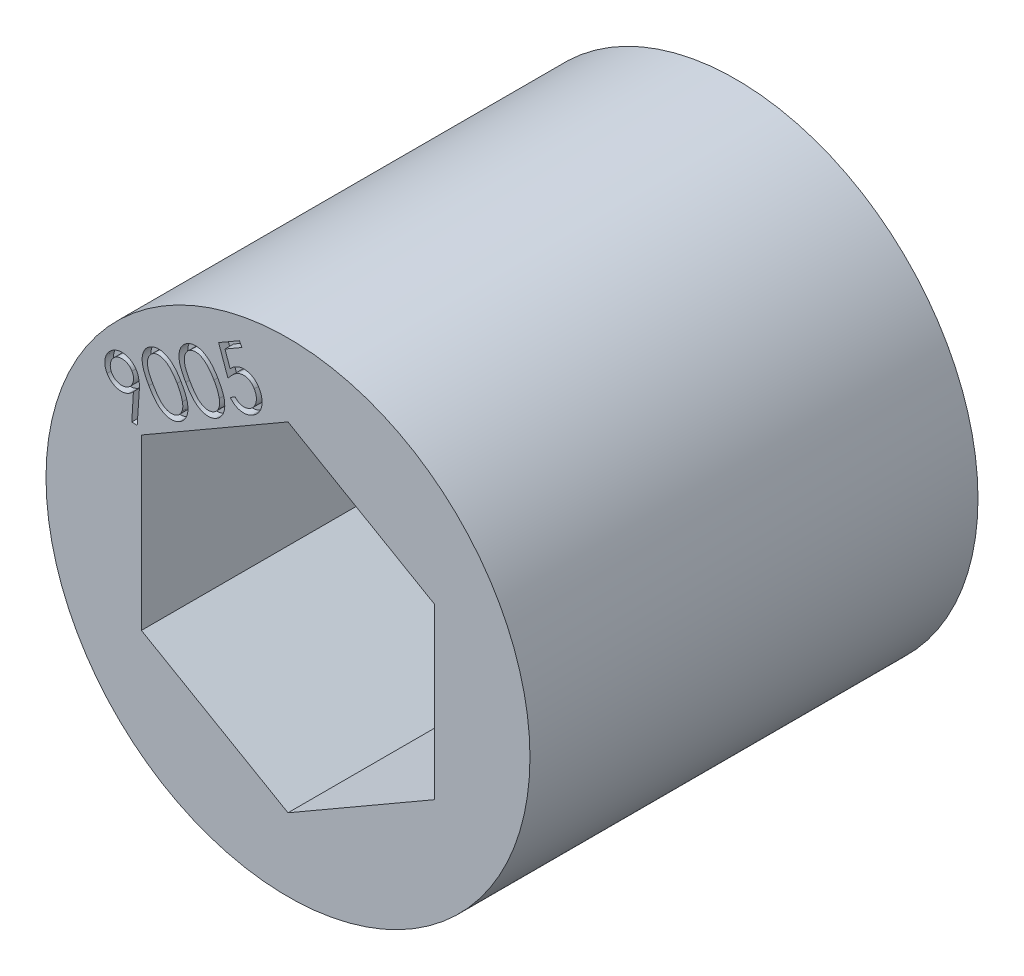
from build123d import *

# Parameters (mm, degrees)
SKETCH1_R           = 11.1125
BOSS_EXTRUDE1_DEPTH = 20.574
CUT_EXTRUDE1_DEPTH  = 0.4


with BuildPart() as part:
    # Sketch1 → Boss-Extrude1 (new body)
    with BuildSketch(Plane.XY):
        Circle(SKETCH1_R)
        Polygon((6.731, 3.886144662), (0, 7.772289324), (-6.731, 3.886144662), (-6.731, -3.886144662), (0, -7.772289324), (6.731, -3.886144662), align=None, mode=Mode.SUBTRACT)
    extrude(amount=BOSS_EXTRUDE1_DEPTH)

    # Sketch2 → Cut-Extrude1 (cut)
    # profile 1 of 4: a face of its own
    with BuildSketch(Plane.XY.offset(20.574)):
        with BuildLine():
            Line((-6.924573237, 4.169554117), (-7.172365705, 4.181765656))
            Line((-7.172365705, 4.181765656), (-7.099096474, 5.424798508))
            add(Edge.make_bspline(
                [(-7.099096474, 5.424798508), (-7.115082491, 5.407369556), (-7.146178835, 5.373466383), (-7.196679552, 5.328749615), (-7.247249931, 5.28893276), (-7.283061917, 5.267076576), (-7.300586859, 5.25638104)],
                knots=[0, 0, 0, 0, 1.07557127, 2.092224476, 3.066411598, 4, 4, 4, 4], degree=3))
            add(Edge.make_bspline(
                [(-7.300586859, 5.25638104), (-7.322245392, 5.244562458), (-7.365097755, 5.221178871), (-7.432394268, 5.194463627), (-7.500523976, 5.17467734), (-7.5697037, 5.163292848), (-7.639544965, 5.157833849), (-7.710525739, 5.160562601), (-7.782232964, 5.170921978), (-7.854086187, 5.188195988), (-7.924350337, 5.211812561), (-7.991348699, 5.241942907), (-8.054290519, 5.278203693), (-8.112922484, 5.320700807), (-8.167757247, 5.368767428), (-8.218277127, 5.422903097), (-8.264381974, 5.483418603), (-8.291278489, 5.527163849), (-8.304985897, 5.549457963)],
                knots=[0, 0, 0, 0, 1.015135184, 2.008489705, 2.974464217, 3.930823522, 4.890110555, 5.854468119, 6.84900024, 7.868689235, 8.893387844, 9.896732215, 10.888539014, 11.878968029, 12.873598221, 13.886496971, 14.922884625, 16, 16, 16, 16], degree=3))
            add(Edge.make_bspline(
                [(-8.304985897, 5.549457963), (-8.321829372, 5.580937848), (-8.35496852, 5.642873798), (-8.388523348, 5.74147864), (-8.41038059, 5.841169826), (-8.416390713, 5.942269443), (-8.410354933, 6.043160996), (-8.3888868, 6.142193846), (-8.354424656, 6.238857598), (-8.306747334, 6.331822917), (-8.247413823, 6.418819647), (-8.178679286, 6.497913682), (-8.099373913, 6.566649861), (-8.040250165, 6.603786522), (-8.010382532, 6.622546906)],
                knots=[0, 0, 0, 0, 1.035324533, 2.036977218, 3.013660684, 3.991039457, 4.968418229, 5.940283026, 6.923354643, 7.941094773, 8.965736768, 9.974485588, 10.976767849, 12, 12, 12, 12], degree=3))
            add(Edge.make_bspline(
                [(-8.010382532, 6.622546906), (-7.979910899, 6.638850823), (-7.919650887, 6.671093082), (-7.822977976, 6.703912105), (-7.723620108, 6.724036171), (-7.622366935, 6.731027877), (-7.521005812, 6.725244635), (-7.42209833, 6.705076571), (-7.326179688, 6.671818439), (-7.23552206, 6.624246651), (-7.150604524, 6.566583058), (-7.074244034, 6.499137059), (-7.007686175, 6.422178737), (-6.971693304, 6.364911211), (-6.953575641, 6.336084566)],
                knots=[0, 0, 0, 0, 1.019400264, 2.015942902, 3.002372847, 4.006779929, 5.005536382, 5.991966327, 6.979044859, 7.994053264, 9.007032045, 10.004279611, 10.995418019, 12, 12, 12, 12], degree=3))
            add(Edge.make_bspline(
                [(-6.953575641, 6.336084566), (-6.94108065, 6.31272698), (-6.915652645, 6.265192989), (-6.885381609, 6.188386689), (-6.861133323, 6.106084415), (-6.845411218, 6.033562631), (-6.836154063, 5.971895301), (-6.830329714, 5.921683006), (-6.827289712, 5.867998445), (-6.824338922, 5.810852315), (-6.824147449, 5.750433103), (-6.825154461, 5.686480995), (-6.8276696, 5.619128602), (-6.830514546, 5.573027762), (-6.831969071, 5.549457963)],
                knots=[0, 0, 0, 0, 1.179517641, 2.400384276, 3.669978525, 4.99951221, 5.702757638, 6.447991837, 7.250775919, 8.098000084, 8.997311831, 9.942054579, 10.947842213, 12, 12, 12, 12], degree=3))
            Line((-6.831969071, 5.549457963), (-6.924573237, 4.169554117))
        make_face()
        with BuildLine():
            add(Edge.make_bspline(
                [(-7.361135737, 5.478223989), (-7.345487269, 5.487746706), (-7.314754829, 5.50644862), (-7.272925048, 5.539525135), (-7.234809529, 5.575039337), (-7.201759778, 5.61461068), (-7.172554575, 5.656996981), (-7.147610177, 5.702548092), (-7.126426025, 5.751143971), (-7.110705102, 5.802616363), (-7.0986576, 5.855119612), (-7.092896712, 5.907849387), (-7.090958642, 5.959787747), (-7.095079997, 6.011179891), (-7.105043932, 6.061513312), (-7.119192538, 6.111409675), (-7.139177576, 6.16045437), (-7.156127013, 6.191897442), (-7.164733494, 6.207863412)],
                knots=[0, 0, 0, 0, 1.045108442, 2.052516081, 3.039037663, 4.014948609, 4.990090363, 5.974041511, 6.976128051, 8.011453109, 9.043011603, 10.047295345, 11.035574291, 12.007150616, 12.98344593, 13.961229243, 14.964765542, 16, 16, 16, 16], degree=3))
            add(Edge.make_bspline(
                [(-7.164733494, 6.207863412), (-7.174089133, 6.223337647), (-7.192579766, 6.25392117), (-7.225361936, 6.295555785), (-7.261221691, 6.333165381), (-7.300583692, 6.366255071), (-7.343021549, 6.395378721), (-7.388421649, 6.420501289), (-7.437279658, 6.440887199), (-7.48859131, 6.45687647), (-7.541170457, 6.468569984), (-7.59379444, 6.475439698), (-7.645815305, 6.476342459), (-7.697101746, 6.472242177), (-7.747829859, 6.463193366), (-7.797786368, 6.448045864), (-7.847496015, 6.428546419), (-7.87894757, 6.411079557), (-7.894881731, 6.402230399)],
                knots=[0, 0, 0, 0, 1.031712043, 2.039092063, 3.018573684, 3.994457873, 4.969572892, 5.953497063, 6.951758218, 7.98705489, 9.018585102, 10.024008046, 11.012022604, 11.983572292, 12.958061913, 13.947831088, 14.960318852, 16, 16, 16, 16], degree=3))
            add(Edge.make_bspline(
                [(-7.894881731, 6.402230399), (-7.910388278, 6.392913988), (-7.940921187, 6.374569665), (-7.982097239, 6.341251164), (-8.020219854, 6.305954392), (-8.053196364, 6.26632484), (-8.082544826, 6.224113666), (-8.106768331, 6.178261226), (-8.128105712, 6.129841495), (-8.143774813, 6.078340812), (-8.155836626, 6.025845148), (-8.161573927, 5.973282237), (-8.163530138, 5.921515103), (-8.159407983, 5.870292051), (-8.149447912, 5.819958724), (-8.135298263, 5.770062336), (-8.115313509, 5.721017647), (-8.098364033, 5.689574574), (-8.089757532, 5.673608604)],
                knots=[0, 0, 0, 0, 1.034021631, 2.036022986, 3.024725885, 4.002794686, 4.980092595, 5.961574923, 6.965877195, 8.00349148, 9.037330872, 10.043835206, 11.024597356, 11.998321951, 12.97677597, 13.956721278, 14.962476515, 16, 16, 16, 16], degree=3))
            add(Edge.make_bspline(
                [(-8.089757532, 5.673608604), (-8.080402299, 5.658133752), (-8.061912467, 5.627549009), (-8.029124446, 5.585923294), (-7.993286198, 5.548280986), (-7.953951832, 5.515402013), (-7.911936753, 5.485891939), (-7.866435331, 5.461124337), (-7.817859582, 5.439909893), (-7.766381593, 5.424197392), (-7.713879847, 5.412147629), (-7.661149682, 5.406387328), (-7.609211423, 5.404449106), (-7.557819252, 5.4085705), (-7.507485838, 5.418534425), (-7.457589474, 5.432683034), (-7.408544779, 5.452668071), (-7.377101707, 5.469617508), (-7.361135737, 5.478223989)],
                knots=[0, 0, 0, 0, 1.033571637, 2.042767394, 3.024014467, 4.001657624, 4.970548117, 5.956245748, 6.96011096, 7.997273687, 9.030663166, 10.03672948, 11.026762591, 12.000063433, 12.97809164, 13.957610489, 14.962928033, 16, 16, 16, 16], degree=3))
        make_face(mode=Mode.SUBTRACT)
    # profile 2 of 4: a face of its own
    with BuildSketch(Plane.XY.offset(20.574)):
        with BuildLine():
            add(Edge.make_bspline(
                [(-6.389027288, 6.017566938), (-6.409133435, 6.05287131), (-6.448236952, 6.121533154), (-6.500873973, 6.223940657), (-6.5479921, 6.321471948), (-6.588289918, 6.414639381), (-6.622135347, 6.503195954), (-6.649104818, 6.587324729), (-6.670478205, 6.66685528), (-6.684728435, 6.74258894), (-6.693459759, 6.815023383), (-6.697441648, 6.88469611), (-6.697696161, 6.952166749), (-6.693111178, 7.017469604), (-6.684045888, 7.080591596), (-6.670272779, 7.141511165), (-6.651816049, 7.200122602), (-6.629460311, 7.256615341), (-6.6032926, 7.310614152), (-6.572189244, 7.360976223), (-6.539018056, 7.4090837), (-6.501460957, 7.453283246), (-6.461212994, 7.495043123), (-6.416749354, 7.532866127), (-6.369393739, 7.568459362), (-6.335448189, 7.58906299), (-6.318302128, 7.599469982)],
                knots=[0, 0, 0, 0, 1.642217524, 3.193873097, 4.653599743, 6.020219012, 7.296149585, 8.484364078, 9.590266645, 10.622995624, 11.596731579, 12.537641419, 13.442669779, 14.322439731, 15.181528583, 16.018162769, 16.844365298, 17.663022962, 18.472528165, 19.266229043, 20.053716379, 20.832379209, 21.608138827, 22.395685855, 23.18965321, 24, 24, 24, 24], degree=3))
            add(Edge.make_bspline(
                [(-6.318302128, 7.599469982), (-6.300474489, 7.609271708), (-6.265131437, 7.628703497), (-6.209787585, 7.652335356), (-6.154045959, 7.672499617), (-6.096960794, 7.687280903), (-6.039102527, 7.697404539), (-5.980071677, 7.703057454), (-5.920188094, 7.704033863), (-5.859484113, 7.700372492), (-5.798152383, 7.692430856), (-5.736739105, 7.678593604), (-5.675517251, 7.65940816), (-5.613945721, 7.636279306), (-5.553264257, 7.606380908), (-5.492313163, 7.572026405), (-5.431183668, 7.533035334), (-5.370608651, 7.487827675), (-5.309343602, 7.437200437), (-5.248722903, 7.379183566), (-5.187834446, 7.314197984), (-5.127591655, 7.241999672), (-5.067536628, 7.162618397), (-5.006762535, 7.076751546), (-4.947049745, 6.983043093), (-4.908357548, 6.917603706), (-4.8885345, 6.884077354)],
                knots=[0, 0, 0, 0, 0.815881076, 1.617473213, 2.411751612, 3.192532544, 3.980223438, 4.766442947, 5.569622482, 6.380892254, 7.204795063, 8.048528362, 8.903143009, 9.777765604, 10.684831081, 11.614241792, 12.584586996, 13.591843045, 14.645331516, 15.771781295, 16.956234458, 18.217113798, 19.542884518, 20.949560407, 22.437178076, 24, 24, 24, 24], degree=3))
            add(Edge.make_bspline(
                [(-4.8885345, 6.884077354), (-4.869530652, 6.850255126), (-4.832467548, 6.784291814), (-4.781234767, 6.686184653), (-4.737228342, 6.591081689), (-4.698597399, 6.499763578), (-4.666653096, 6.411920287), (-4.640306006, 6.327614929), (-4.620396404, 6.246737064), (-4.6063935, 6.169055221), (-4.598603188, 6.094211015), (-4.593971274, 6.022202966), (-4.595400477, 5.952523966), (-4.599979685, 5.885128312), (-4.610491525, 5.820080305), (-4.624506818, 5.757237794), (-4.643374509, 5.696973407), (-4.666941719, 5.639407798), (-4.694183707, 5.584543463), (-4.725674846, 5.533004056), (-4.759484853, 5.483999185), (-4.797252883, 5.438330896), (-4.839447463, 5.396814623), (-4.883987575, 5.35750714), (-4.93219409, 5.321382207), (-4.966703412, 5.300529969), (-4.984191551, 5.289962771)],
                knots=[0, 0, 0, 0, 1.558572261, 3.039675171, 4.44500239, 5.767404933, 7.021920233, 8.19867626, 9.314183841, 10.366093107, 11.366862767, 12.335955634, 13.262731656, 14.164729598, 15.047477431, 15.907015182, 16.749641984, 17.580952634, 18.403702246, 19.207672054, 20.005351578, 20.794016824, 21.584181799, 22.380929523, 23.179510693, 24, 24, 24, 24], degree=3))
            add(Edge.make_bspline(
                [(-4.984191551, 5.289962771), (-5.001707815, 5.280398375), (-5.036487948, 5.261407397), (-5.090424565, 5.237293305), (-5.145760575, 5.218713906), (-5.201565282, 5.203563548), (-5.258522917, 5.194204812), (-5.316138998, 5.188366749), (-5.374836605, 5.187510596), (-5.434253982, 5.19085035), (-5.493895069, 5.199844146), (-5.553639391, 5.212682554), (-5.612762156, 5.232078045), (-5.672049751, 5.255375395), (-5.731144466, 5.284104522), (-5.790200814, 5.31763903), (-5.848795364, 5.35668413), (-5.907832517, 5.400497199), (-5.966485881, 5.451344089), (-6.025807257, 5.50924311), (-6.085659079, 5.574770443), (-6.145595752, 5.648407462), (-6.206315193, 5.729467377), (-6.266921655, 5.818563605), (-6.328918742, 5.914869108), (-6.368587219, 5.982644272), (-6.389027288, 6.017566938)],
                knots=[0, 0, 0, 0, 0.807491903, 1.603348545, 2.386916451, 3.167713854, 3.940658363, 4.719915701, 5.50935356, 6.313835313, 7.125313705, 7.947948844, 8.783651521, 9.640150085, 10.524255013, 11.440287308, 12.386399569, 13.372019105, 14.413529699, 15.525036669, 16.724996316, 18.002813491, 19.365932914, 20.822335035, 22.362637201, 24, 24, 24, 24], degree=3))
        make_face()
        with BuildLine():
            add(Edge.make_bspline(
                [(-6.178887064, 6.133067739), (-6.161426429, 6.103110337), (-6.127615012, 6.045099717), (-6.075562681, 5.962541829), (-6.024679761, 5.886803909), (-5.975569273, 5.817418966), (-5.927311523, 5.755166928), (-5.879859047, 5.700199785), (-5.834156819, 5.65148208), (-5.789064755, 5.609378951), (-5.744235972, 5.572833103), (-5.699427311, 5.540619065), (-5.654149077, 5.512669859), (-5.608806841, 5.488586996), (-5.563034266, 5.468596404), (-5.517073037, 5.452114899), (-5.470451641, 5.440634387), (-5.40939359, 5.4296989), (-5.334415628, 5.425511888), (-5.247777632, 5.434167276), (-5.165788161, 5.45555361), (-5.1162741, 5.480855148), (-5.091551326, 5.493488412)],
                knots=[0, 0, 0, 0, 1.475228016, 2.856686104, 4.15161897, 5.357081144, 6.47289893, 7.501387829, 8.445726694, 9.313720896, 10.124066195, 10.905058304, 11.660046733, 12.386348828, 13.08755313, 13.783651734, 14.460982071, 15.127735434, 16.421461315, 17.639985157, 18.821625413, 20, 20, 20, 20], degree=3))
            add(Edge.make_bspline(
                [(-5.091551326, 5.493488412), (-5.068050045, 5.508642633), (-5.021313431, 5.538779584), (-4.961478465, 5.598510023), (-4.911472366, 5.668409922), (-4.878039915, 5.734188546), (-4.85741428, 5.791297255), (-4.844382179, 5.836586753), (-4.836028368, 5.884173817), (-4.830714321, 5.933481805), (-4.830160258, 5.98468181), (-4.831895448, 6.037724108), (-4.838141277, 6.092619979), (-4.844899008, 6.129541753), (-4.848338185, 6.148332162)],
                knots=[0, 0, 0, 0, 1.342886321, 2.670576022, 4.038999414, 5.466462105, 6.205051725, 6.959707281, 7.731476591, 8.527516338, 9.344012544, 10.193626534, 11.080691652, 12, 12, 12, 12], degree=3))
            add(Edge.make_bspline(
                [(-4.848338185, 6.148332162), (-4.853141463, 6.172143603), (-4.862917253, 6.220605433), (-4.883241578, 6.293308409), (-4.907130982, 6.367897796), (-4.935515036, 6.443785885), (-4.968511178, 6.52100751), (-5.005013452, 6.599902304), (-5.046232724, 6.680377927), (-5.076591587, 6.733750011), (-5.092060141, 6.760944341)],
                knots=[0, 0, 0, 0, 0.879876913, 1.790754508, 2.73331625, 3.717259664, 4.725112015, 5.77538776, 6.866507818, 8, 8, 8, 8], degree=3))
            add(Edge.make_bspline(
                [(-5.092060141, 6.760944341), (-5.10779362, 6.787870192), (-5.138577546, 6.840552969), (-5.187171406, 6.915532581), (-5.23481293, 6.986156956), (-5.283133724, 7.051404219), (-5.332035694, 7.111199826), (-5.38028546, 7.166630757), (-5.429164096, 7.216445862), (-5.478121542, 7.261411746), (-5.526964594, 7.301536188), (-5.575131793, 7.337407737), (-5.623421228, 7.368040967), (-5.671156297, 7.394770451), (-5.718883008, 7.416498809), (-5.766067149, 7.4341661), (-5.813070596, 7.44701248), (-5.874327029, 7.457455208), (-5.948859172, 7.461753569), (-6.034923974, 7.45390492), (-6.116120824, 7.432318475), (-6.165175383, 7.407346344), (-6.18957216, 7.394926713)],
                knots=[0, 0, 0, 0, 1.327522451, 2.597413504, 3.803087542, 4.954092809, 6.052504639, 7.091116491, 8.08170511, 9.022070092, 9.919800897, 10.771882377, 11.577119672, 12.352806521, 13.099205072, 13.807429758, 14.495830891, 15.170113202, 16.450227669, 17.661618134, 18.837030004, 20, 20, 20, 20], degree=3))
            add(Edge.make_bspline(
                [(-6.18957216, 7.394926713), (-6.213108079, 7.379804023), (-6.260014083, 7.349665196), (-6.319558549, 7.289176728), (-6.370592085, 7.218882513), (-6.403603294, 7.151837696), (-6.425564344, 7.09426742), (-6.437351048, 7.048251661), (-6.446735168, 7.000730481), (-6.452444929, 6.951215807), (-6.453496603, 6.89985207), (-6.452395294, 6.846792003), (-6.446212657, 6.792159865), (-6.43786597, 6.735131452), (-6.424338023, 6.674922828), (-6.405316357, 6.610738959), (-6.38059286, 6.542128376), (-6.351092592, 6.468717826), (-6.315846632, 6.391109635), (-6.275361547, 6.308870657), (-6.229827267, 6.222012401), (-6.196212479, 6.163318957), (-6.178887064, 6.133067739)],
                knots=[0, 0, 0, 0, 1.186584607, 2.364808541, 3.584028067, 4.867913378, 5.52979883, 6.201670858, 6.884946004, 7.589109066, 8.317961587, 9.068444384, 9.84432244, 10.65432116, 11.518850237, 12.466086659, 13.499587148, 14.619373863, 15.830028341, 17.123623296, 18.517485242, 20, 20, 20, 20], degree=3))
        make_face(mode=Mode.SUBTRACT)
    # profile 3 of 4: a face of its own
    with BuildSketch(Plane.XY.offset(20.574)):
        with BuildLine():
            add(Edge.make_bspline(
                [(-4.696946884, 6.994490014), (-4.71705303, 7.029794386), (-4.756156547, 7.098456231), (-4.808793569, 7.200863734), (-4.855911696, 7.298395024), (-4.896209514, 7.391562458), (-4.930054943, 7.480119031), (-4.957024413, 7.564247806), (-4.9783978, 7.643778357), (-4.992648031, 7.719512017), (-5.001379354, 7.79194646), (-5.005361243, 7.861619187), (-5.005615756, 7.929089826), (-5.001030774, 7.994392681), (-4.991965484, 8.057514673), (-4.978192374, 8.118434241), (-4.959735644, 8.177045679), (-4.937379907, 8.233538418), (-4.911212196, 8.287537229), (-4.880108839, 8.337899299), (-4.846937652, 8.386006777), (-4.809380553, 8.430206323), (-4.769132589, 8.4719662), (-4.72466895, 8.509789204), (-4.677313335, 8.545382439), (-4.643367784, 8.565986067), (-4.626221723, 8.576393059)],
                knots=[0, 0, 0, 0, 1.642217524, 3.193873097, 4.653599743, 6.020219012, 7.296149585, 8.484364078, 9.590266645, 10.622995624, 11.596731579, 12.537641419, 13.442669779, 14.322439731, 15.181528583, 16.018162769, 16.844365298, 17.663022962, 18.472528165, 19.266229043, 20.053716379, 20.832379209, 21.608138827, 22.395685855, 23.18965321, 24, 24, 24, 24], degree=3))
            add(Edge.make_bspline(
                [(-4.626221723, 8.576393059), (-4.608394085, 8.586194785), (-4.573051033, 8.605626574), (-4.517707181, 8.629258433), (-4.461965555, 8.649422694), (-4.404880389, 8.66420398), (-4.347022123, 8.674327616), (-4.287991273, 8.679980531), (-4.22810769, 8.68095694), (-4.167403709, 8.677295569), (-4.106071979, 8.669353933), (-4.0446587, 8.655516681), (-3.983436846, 8.636331237), (-3.921865317, 8.613202383), (-3.861183853, 8.583303985), (-3.800232759, 8.548949482), (-3.739103264, 8.509958411), (-3.678528247, 8.464750752), (-3.617263198, 8.414123514), (-3.556642499, 8.356106643), (-3.495754042, 8.291121061), (-3.43551125, 8.218922749), (-3.375456224, 8.139541474), (-3.314682131, 8.053674623), (-3.254969341, 7.95996617), (-3.216277144, 7.894526783), (-3.196454095, 7.861000431)],
                knots=[0, 0, 0, 0, 0.815881076, 1.617473213, 2.411751612, 3.192532544, 3.980223438, 4.766442947, 5.569622482, 6.380892254, 7.204795063, 8.048528362, 8.903143009, 9.777765604, 10.684831081, 11.614241792, 12.584586996, 13.591843045, 14.645331516, 15.771781295, 16.956234458, 18.217113798, 19.542884518, 20.949560407, 22.437178076, 24, 24, 24, 24], degree=3))
            add(Edge.make_bspline(
                [(-3.196454095, 7.861000431), (-3.177450247, 7.827178203), (-3.140387144, 7.761214891), (-3.089154363, 7.66310773), (-3.045147938, 7.568004765), (-3.006516995, 7.476686655), (-2.974572692, 7.388843364), (-2.948225601, 7.304538006), (-2.928315999, 7.223660141), (-2.914313096, 7.145978298), (-2.906522783, 7.071134092), (-2.90189087, 6.999126042), (-2.903320072, 6.929447043), (-2.907899281, 6.862051389), (-2.918411121, 6.797003382), (-2.932426414, 6.734160871), (-2.951294105, 6.673896484), (-2.974861315, 6.616330875), (-3.002103303, 6.56146654), (-3.033594442, 6.509927133), (-3.067404448, 6.460922262), (-3.105172479, 6.415253973), (-3.147367059, 6.3737377), (-3.191907171, 6.334430217), (-3.240113685, 6.298305283), (-3.274623007, 6.277453046), (-3.292111146, 6.266885848)],
                knots=[0, 0, 0, 0, 1.558572261, 3.039675171, 4.44500239, 5.767404933, 7.021920233, 8.19867626, 9.314183841, 10.366093107, 11.366862767, 12.335955634, 13.262731656, 14.164729598, 15.047477431, 15.907015182, 16.749641984, 17.580952634, 18.403702246, 19.207672054, 20.005351578, 20.794016824, 21.584181799, 22.380929523, 23.179510693, 24, 24, 24, 24], degree=3))
            add(Edge.make_bspline(
                [(-3.292111146, 6.266885848), (-3.30962741, 6.257321452), (-3.344407543, 6.238330474), (-3.398344161, 6.214216382), (-3.45368017, 6.195636983), (-3.509484877, 6.180486625), (-3.566442512, 6.171127889), (-3.624058593, 6.165289826), (-3.682756201, 6.164433673), (-3.742173577, 6.167773427), (-3.801814665, 6.176767223), (-3.861558986, 6.189605631), (-3.920681752, 6.209001121), (-3.979969346, 6.232298472), (-4.039064062, 6.261027599), (-4.098120409, 6.294562107), (-4.15671496, 6.333607207), (-4.215752113, 6.377420276), (-4.274405477, 6.428267166), (-4.333726852, 6.486166187), (-4.393578674, 6.55169352), (-4.453515348, 6.625330539), (-4.514234788, 6.706390454), (-4.57484125, 6.795486682), (-4.636838337, 6.891792185), (-4.676506815, 6.959567349), (-4.696946884, 6.994490014)],
                knots=[0, 0, 0, 0, 0.807491903, 1.603348545, 2.386916451, 3.167713854, 3.940658363, 4.719915701, 5.50935356, 6.313835313, 7.125313705, 7.947948844, 8.783651521, 9.640150085, 10.524255013, 11.440287308, 12.386399569, 13.372019105, 14.413529699, 15.525036669, 16.724996316, 18.002813491, 19.365932914, 20.822335035, 22.362637201, 24, 24, 24, 24], degree=3))
        make_face()
        with BuildLine():
            add(Edge.make_bspline(
                [(-4.486806659, 7.109990816), (-4.469346025, 7.080033414), (-4.435534607, 7.022022794), (-4.383482277, 6.939464906), (-4.332599357, 6.863726986), (-4.283488868, 6.794342043), (-4.235231119, 6.732090005), (-4.187778642, 6.677122862), (-4.142076415, 6.628405157), (-4.096984351, 6.586302028), (-4.052155568, 6.54975618), (-4.007346907, 6.517542142), (-3.962068673, 6.489592936), (-3.916726437, 6.465510073), (-3.870953862, 6.445519481), (-3.824992633, 6.429037976), (-3.778371237, 6.417557464), (-3.717313185, 6.406621977), (-3.642335224, 6.402434964), (-3.555697227, 6.411090353), (-3.473707757, 6.432476687), (-3.424193695, 6.457778225), (-3.399470922, 6.470411489)],
                knots=[0, 0, 0, 0, 1.475228016, 2.856686104, 4.15161897, 5.357081144, 6.47289893, 7.501387829, 8.445726694, 9.313720896, 10.124066195, 10.905058304, 11.660046733, 12.386348828, 13.08755313, 13.783651734, 14.460982071, 15.127735434, 16.421461315, 17.639985157, 18.821625413, 20, 20, 20, 20], degree=3))
            add(Edge.make_bspline(
                [(-3.399470922, 6.470411489), (-3.37596964, 6.48556571), (-3.329233027, 6.515702661), (-3.269398061, 6.5754331), (-3.219391961, 6.645332999), (-3.18595951, 6.711111623), (-3.165333876, 6.768220332), (-3.152301774, 6.81350983), (-3.143947963, 6.861096894), (-3.138633917, 6.910404882), (-3.138079853, 6.961604887), (-3.139815043, 7.014647185), (-3.146060872, 7.069543056), (-3.152818604, 7.10646483), (-3.156257781, 7.125255239)],
                knots=[0, 0, 0, 0, 1.342886321, 2.670576022, 4.038999414, 5.466462105, 6.205051725, 6.959707281, 7.731476591, 8.527516338, 9.344012544, 10.193626534, 11.080691652, 12, 12, 12, 12], degree=3))
            add(Edge.make_bspline(
                [(-3.156257781, 7.125255239), (-3.161061059, 7.14906668), (-3.170836848, 7.19752851), (-3.191161173, 7.270231486), (-3.215050577, 7.344820873), (-3.243434631, 7.420708962), (-3.276430774, 7.497930587), (-3.312933047, 7.576825381), (-3.35415232, 7.657301004), (-3.384511183, 7.710673088), (-3.399979736, 7.737867418)],
                knots=[0, 0, 0, 0, 0.879876913, 1.790754508, 2.73331625, 3.717259664, 4.725112015, 5.77538776, 6.866507818, 8, 8, 8, 8], degree=3))
            add(Edge.make_bspline(
                [(-3.399979736, 7.737867418), (-3.415713216, 7.764793269), (-3.446497141, 7.817476046), (-3.495091002, 7.892455658), (-3.542732526, 7.963080033), (-3.59105332, 8.028327296), (-3.639955289, 8.088122903), (-3.688205055, 8.143553834), (-3.737083692, 8.193368939), (-3.786041138, 8.238334823), (-3.83488419, 8.278459265), (-3.883051388, 8.314330813), (-3.931340824, 8.344964044), (-3.979075893, 8.371693527), (-4.026802604, 8.393421886), (-4.073986745, 8.411089176), (-4.120990191, 8.423935557), (-4.182246625, 8.434378284), (-4.256778767, 8.438676646), (-4.342843569, 8.430827997), (-4.42404042, 8.409241552), (-4.473094979, 8.384269421), (-4.497491755, 8.37184979)],
                knots=[0, 0, 0, 0, 1.327522451, 2.597413504, 3.803087542, 4.954092809, 6.052504639, 7.091116491, 8.08170511, 9.022070092, 9.919800897, 10.771882377, 11.577119672, 12.352806521, 13.099205072, 13.807429758, 14.495830891, 15.170113202, 16.450227669, 17.661618134, 18.837030004, 20, 20, 20, 20], degree=3))
            add(Edge.make_bspline(
                [(-4.497491755, 8.37184979), (-4.521027674, 8.3567271), (-4.567933678, 8.326588273), (-4.627478145, 8.266099805), (-4.678511681, 8.19580559), (-4.711522889, 8.128760773), (-4.73348394, 8.071190497), (-4.745270643, 8.025174737), (-4.754654764, 7.977653558), (-4.760364525, 7.928138884), (-4.761416198, 7.876775147), (-4.760314889, 7.82371508), (-4.754132252, 7.769082942), (-4.745785566, 7.712054529), (-4.732257619, 7.651845905), (-4.713235953, 7.587662036), (-4.688512455, 7.519051453), (-4.659012188, 7.445640903), (-4.623766228, 7.368032712), (-4.583281143, 7.285793734), (-4.537746863, 7.198935478), (-4.504132074, 7.140242033), (-4.486806659, 7.109990816)],
                knots=[0, 0, 0, 0, 1.186584607, 2.364808541, 3.584028067, 4.867913378, 5.52979883, 6.201670858, 6.884946004, 7.589109066, 8.317961587, 9.068444384, 9.84432244, 10.65432116, 11.518850237, 12.466086659, 13.499587148, 14.619373863, 15.830028341, 17.123623296, 18.517485242, 20, 20, 20, 20], degree=3))
        make_face(mode=Mode.SUBTRACT)
    # profile 4 of 4: a face of its own
    with BuildSketch(Plane.XY.offset(20.574)):
        with BuildLine():
            Line((-2.232486672, 9.884554117), (-2.111388915, 9.675431521))
            Line((-2.111388915, 9.675431521), (-2.894453819, 9.223604598))
            Line((-2.894453819, 9.223604598), (-2.657855261, 8.560619822))
            add(Edge.make_bspline(
                [(-2.657855261, 8.560619822), (-2.638218533, 8.580338731), (-2.600092727, 8.618624094), (-2.541381873, 8.670652555), (-2.482526582, 8.71488419), (-2.442302052, 8.739829327), (-2.422783146, 8.751933925)],
                knots=[0, 0, 0, 0, 1.098290535, 2.132392437, 3.093745641, 4, 4, 4, 4], degree=3))
            add(Edge.make_bspline(
                [(-2.422783146, 8.751933925), (-2.397914272, 8.765466609), (-2.349183331, 8.791984111), (-2.273295455, 8.82308226), (-2.197167762, 8.84624648), (-2.12042962, 8.861133801), (-2.043348541, 8.867733077), (-1.965869777, 8.866390749), (-1.888374446, 8.855780996), (-1.811157491, 8.83810549), (-1.735754109, 8.812874738), (-1.663606735, 8.780176763), (-1.595572431, 8.740260316), (-1.531636107, 8.693183696), (-1.472054916, 8.63890757), (-1.416143329, 8.577953953), (-1.36471065, 8.509656199), (-1.334528109, 8.46014412), (-1.319165358, 8.434942739)],
                knots=[0, 0, 0, 0, 1.055226793, 2.0677331, 3.052212554, 4.018542703, 4.977162288, 5.932437355, 6.902135778, 7.888705833, 8.882789797, 9.862196838, 10.837428505, 11.819120356, 12.817701552, 13.838412957, 14.899763852, 16, 16, 16, 16], degree=3))
            add(Edge.make_bspline(
                [(-1.319165358, 8.434942739), (-1.309058675, 8.41693361), (-1.288993775, 8.381179899), (-1.263867573, 8.325510709), (-1.241866621, 8.269496738), (-1.223418161, 8.212985882), (-1.209035322, 8.155705824), (-1.199041999, 8.097678336), (-1.192326544, 8.038896079), (-1.189400711, 7.97976396), (-1.189647066, 7.920945833), (-1.194467516, 7.863181618), (-1.202339266, 7.806672746), (-1.214717104, 7.751633041), (-1.230609255, 7.697954506), (-1.249763773, 7.645425907), (-1.273369156, 7.594539884), (-1.300392645, 7.545077905), (-1.330841012, 7.49719175), (-1.365117495, 7.451507474), (-1.402123517, 7.407471426), (-1.443314315, 7.366191422), (-1.487478206, 7.326611691), (-1.534813782, 7.288730971), (-1.586062207, 7.25358796), (-1.621967652, 7.23192752), (-1.640227056, 7.22091229)],
                knots=[0, 0, 0, 0, 1.056118218, 2.096722398, 3.121577719, 4.134163306, 5.135945977, 6.140280965, 7.144540977, 8.161134175, 9.167753235, 10.151407743, 11.12455722, 12.084580427, 13.03459039, 13.987251861, 14.942399827, 15.901559881, 16.869239022, 17.84285264, 18.821711144, 19.809604986, 20.823528204, 21.854828758, 22.909091632, 24, 24, 24, 24], degree=3))
            add(Edge.make_bspline(
                [(-1.640227056, 7.22091229), (-1.66245052, 7.208890275), (-1.706126774, 7.185263148), (-1.773620686, 7.155755615), (-1.841842249, 7.13435667), (-1.910075445, 7.117850872), (-1.978859824, 7.109429533), (-2.047991458, 7.107522779), (-2.117550424, 7.111312259), (-2.186810854, 7.122759479), (-2.254774299, 7.139862843), (-2.320253082, 7.163027341), (-2.383125758, 7.19115098), (-2.442254662, 7.226644213), (-2.499689462, 7.265789198), (-2.553039833, 7.312367013), (-2.60433984, 7.363538717), (-2.635122357, 7.401583901), (-2.650731864, 7.420876232)],
                knots=[0, 0, 0, 0, 1.072134106, 2.107088345, 3.120082218, 4.103094204, 5.082515459, 6.054688821, 7.035326059, 8.034103215, 9.029216361, 10.005856331, 10.978669035, 11.946542555, 12.928974578, 13.924426104, 14.947497235, 16, 16, 16, 16], degree=3))
            Line((-2.650731864, 7.420876232), (-2.425327217, 7.551132643))
            add(Edge.make_bspline(
                [(-2.425327217, 7.551132643), (-2.409077906, 7.533451041), (-2.377751672, 7.499363564), (-2.326366342, 7.456154334), (-2.274862189, 7.42008868), (-2.22121916, 7.393505853), (-2.165848411, 7.374143007), (-2.107930256, 7.36288908), (-2.047404868, 7.35692484), (-1.984793793, 7.358898662), (-1.921741476, 7.36655269), (-1.860379425, 7.382141943), (-1.801179078, 7.40389435), (-1.764171454, 7.423654524), (-1.745551576, 7.433596585)],
                knots=[0, 0, 0, 0, 1.147520606, 2.21224761, 3.204571573, 4.147865415, 5.066343476, 6.001860765, 6.963294874, 7.969548374, 8.991893607, 9.995363551, 10.991394674, 12, 12, 12, 12], degree=3))
            add(Edge.make_bspline(
                [(-1.745551576, 7.433596585), (-1.7279729, 7.444215186), (-1.693234503, 7.465199314), (-1.646589237, 7.503347699), (-1.604340751, 7.544784913), (-1.567104605, 7.590404804), (-1.534198705, 7.639749097), (-1.507352107, 7.693806368), (-1.484911954, 7.751548353), (-1.467264388, 7.812655172), (-1.45501877, 7.875636916), (-1.449308107, 7.93923884), (-1.450446969, 8.002484737), (-1.457664503, 8.065508295), (-1.470853164, 8.128461405), (-1.491022381, 8.191003842), (-1.516756165, 8.253575382), (-1.538902411, 8.293524907), (-1.55016696, 8.313844982)],
                knots=[0, 0, 0, 0, 0.980403286, 1.937440499, 2.871723006, 3.804773995, 4.746760611, 5.700152217, 6.68309888, 7.704111624, 8.735847065, 9.744916973, 10.7501705, 11.753624989, 12.7726731, 13.818607765, 14.890448496, 16, 16, 16, 16], degree=3))
            add(Edge.make_bspline(
                [(-1.55016696, 8.313844982), (-1.561079465, 8.331666557), (-1.582428373, 8.366532169), (-1.618700933, 8.414887589), (-1.658558259, 8.457328856), (-1.700436405, 8.495803848), (-1.745946267, 8.528131982), (-1.793930161, 8.556123238), (-1.845401538, 8.577807916), (-1.898967986, 8.595110703), (-1.954340946, 8.607078209), (-2.010538978, 8.611832261), (-2.067138725, 8.611510063), (-2.124104177, 8.604789839), (-2.181545997, 8.591936618), (-2.239085694, 8.572705753), (-2.297631899, 8.548545074), (-2.335291406, 8.527601194), (-2.354602056, 8.516861809)],
                knots=[0, 0, 0, 0, 1.07318392, 2.099545848, 3.098281199, 4.060630323, 5.015734557, 5.96024906, 6.908653524, 7.87854567, 8.849141968, 9.811491091, 10.769927648, 11.75230143, 12.752138279, 13.788107204, 14.865808624, 16, 16, 16, 16], degree=3))
            add(Edge.make_bspline(
                [(-2.354602056, 8.516861809), (-2.371051964, 8.506939509), (-2.404968986, 8.486481346), (-2.453862122, 8.450019029), (-2.503663937, 8.40898402), (-2.553849622, 8.362855242), (-2.604156339, 8.310976515), (-2.655765753, 8.254745341), (-2.706824449, 8.192498773), (-2.740399635, 8.148909577), (-2.757582826, 8.126601393)],
                knots=[0, 0, 0, 0, 0.816257212, 1.682988962, 2.589562383, 3.559120875, 4.578856269, 5.660923536, 6.802901792, 8, 8, 8, 8], degree=3))
            Line((-2.757582826, 8.126601393), (-3.184477858, 9.335034886))
            Line((-3.184477858, 9.335034886), (-2.232486672, 9.884554117))
        make_face()
    extrude(amount=-CUT_EXTRUDE1_DEPTH, mode=Mode.SUBTRACT)


solid = part.part
